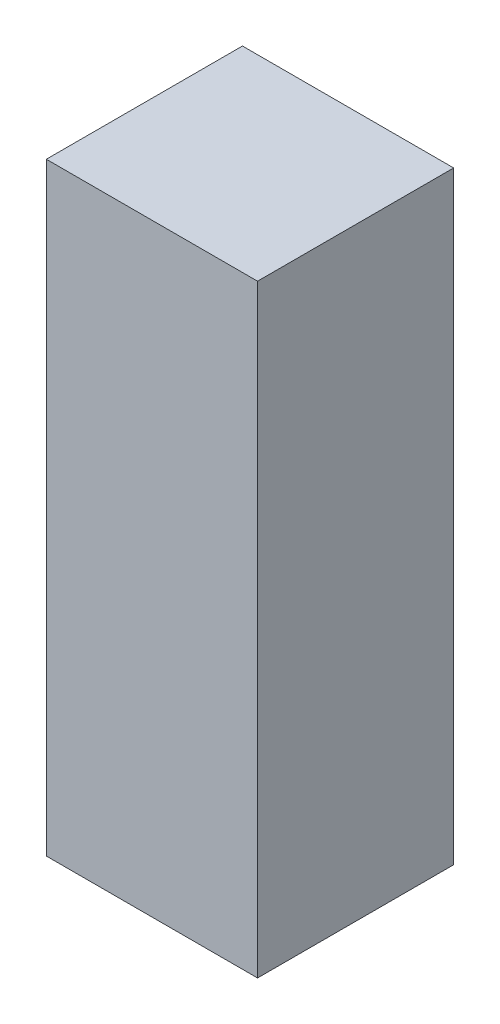
from build123d import *

# Parameters (mm, degrees)
PACK_PANO_KAPAGI_MENTESE_2_1_START = 20
SKETCH1_W                          = 14
SKETCH1_H                          = 40
PACK_PANO_KAPAGI_MENTESE_2_1_DEPTH = 13


with BuildPart() as part:
    # Sketch1 → PACK_pano_kapagi_mentese_2_1 (new body)
    with BuildSketch(Plane.XY.offset(PACK_PANO_KAPAGI_MENTESE_2_1_START)):
        with Locations((31, 240)):
            Rectangle(SKETCH1_W, SKETCH1_H)
    extrude(amount=PACK_PANO_KAPAGI_MENTESE_2_1_DEPTH)


solid = part.part
